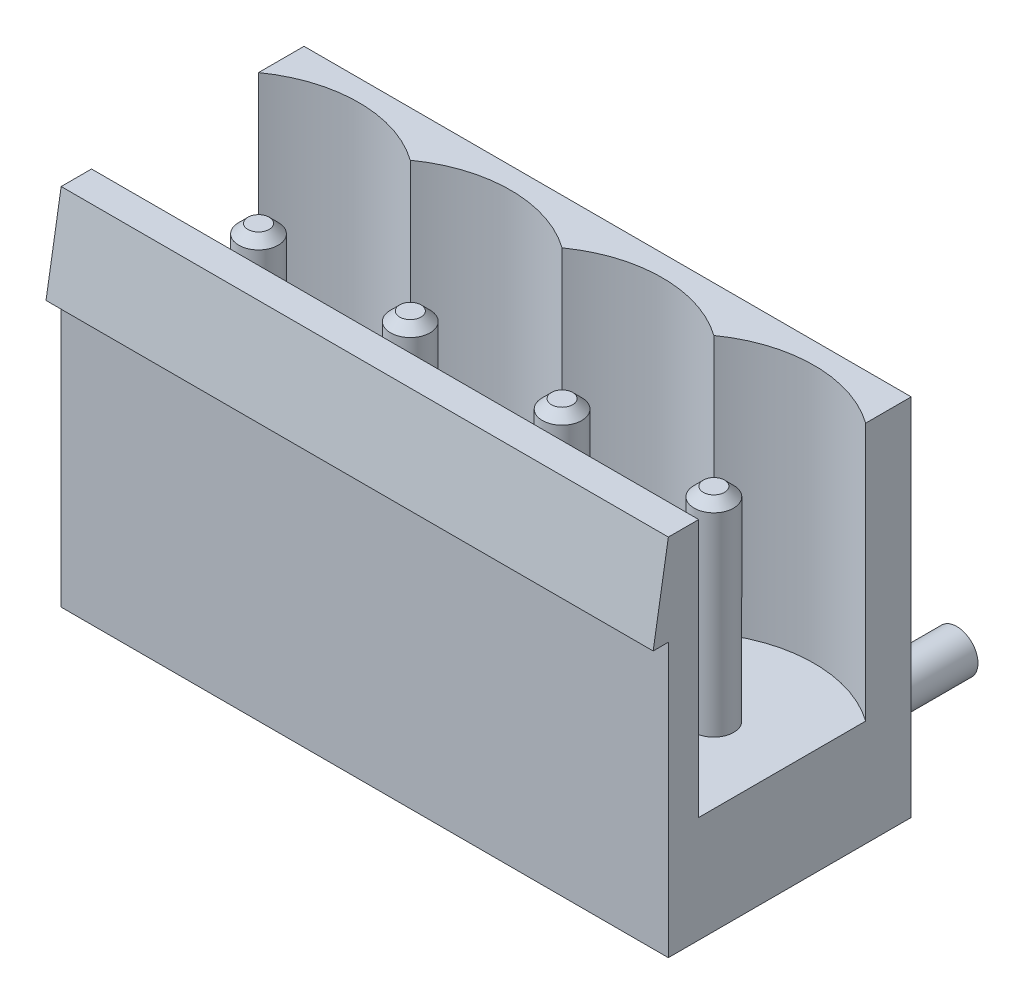
from build123d import *

# Parameters (mm, degrees)
EXTRUDE_1_DEPTH                    = 20
SKETCH_5_R                         = 0.7
EXTRUDE_3_DEPTH                    = 4
CUT_EXTRUDE_1_DEPTH                = 8.5
SKETCH_7_R                         = 0.65
EXTRUDE_4_DEPTH                    = 6.7
CHAMFER_1_SIZE                     = 0.3
PATTERN_LINEAR_2_COUNT             = 4
PATTERN_LINEAR_2_PITCH             = 5
PATTERN_LINEAR_3_COUNT             = 4
PATTERN_LINEAR_3_PITCH             = 5
CHAMFER_1_OF_PATTERN_LINEAR_3_SIZE = 0.3
EXTRUDE_5_DEPTH                    = 0.5
EXTRUDE_6_DEPTH                    = 0.5
CUT_EXTRUDE_2_REACH                = 28.613
SKETCH_10_W                        = 0.5
SKETCH_10_H                        = 8.5


with BuildPart() as part:
    # Эскиз1 → Вытянуть1 (new body)
    with BuildSketch(Plane(origin=(0, 0, 0), x_dir=(0, -1, 0), z_dir=(1, 0, 0))):
        Polygon((-9, 0), (-9, -0.5), (-12, 0), (-12, 8), (0, 8), (0, 0), align=None)
    extrude(amount=EXTRUDE_1_DEPTH)

    # Эскиз5 → Вытянуть3 (add)
    with BuildSketch(Plane(origin=(0, 8, -8), x_dir=(1, 0, 0), z_dir=(0, 0, 1))):
        with Locations((2.5, -6.5)):
            Circle(SKETCH_5_R)
    extrude_3 = extrude(amount=-EXTRUDE_3_DEPTH)

    # Эскиз6 → Вырез-Вытянуть1 (cut)
    with BuildSketch(Plane(origin=(0, 12, 0), x_dir=(1, 0, 0), z_dir=(0, 1, 0))):
        with BuildLine():
            Line((0, 6.5), (0, 1))
            Line((0, 1), (5, 1))
            Line((5, 1), (5, 6.5))
            ThreePointArc((5, 6.5), (2.5, 7.3), (0, 6.5))
        make_face()
    cut_extrude_1 = extrude(amount=-CUT_EXTRUDE_1_DEPTH, mode=Mode.SUBTRACT)

    # Эскиз7 → Вытянуть4 (add)
    with BuildSketch(Plane(origin=(0, 3.5, 0), x_dir=(1, 0, 0), z_dir=(0, 1, 0))):
        with Locations(Location((2.5, 4, 0), (0, 0, 90))):
            Circle(SKETCH_7_R)
    extrude_4 = extrude(amount=EXTRUDE_4_DEPTH)

    # Фаска1
    chamfer_1_edges = [part.edges().sort_by_distance(p)[0] for p in [
        (2.5, 10.2, -3.35),
    ]]
    chamfer(chamfer_1_edges, length=CHAMFER_1_SIZE)

    # Линейный массив2: Вытянуть3, Вырез-Вытянуть1 ×4
    with Locations(*[(i * PATTERN_LINEAR_2_PITCH, 0, 0) for i in range(1, PATTERN_LINEAR_2_COUNT)]):
        add(extrude_3)
        add(cut_extrude_1, mode=Mode.SUBTRACT)

    # Линейный массив3: Вытянуть4 ×4
    with Locations(*[(i * PATTERN_LINEAR_3_PITCH, 0, 0) for i in range(1, PATTERN_LINEAR_3_COUNT)]):
        add(extrude_4)

    # Фаска1 of Линейный массив3
    chamfer_1_of_pattern_linear_3_edges = [part.edges().sort_by_distance(p)[0] for p in [
        (7.5, 10.2, -3.35),
        (12.5, 10.2, -3.35),
        (17.5, 10.2, -3.35),
    ]]
    chamfer(chamfer_1_of_pattern_linear_3_edges, length=CHAMFER_1_OF_PATTERN_LINEAR_3_SIZE)

    # Эскиз8 → Вытянуть5 (add)
    with BuildSketch(Plane(origin=(20, 0, 0), x_dir=(0, 0, -1), z_dir=(1, 0, 0))):
        Polygon((0, 12), (8, 12), (8, 0), (0, 0), (0, 9), (-0.5, 9), align=None)
    extrude(amount=EXTRUDE_5_DEPTH)

    # Эскиз9 → Вытянуть6 (add)
    with BuildSketch(Plane.ZY):
        Polygon((-8, 12), (0, 12), (0.5, 9), (0, 9), (0, 0), (-8, 0), align=None)
    extrude(amount=EXTRUDE_6_DEPTH)

    # Эскиз10 → Вырез-Вытянуть2 (cut, up to next)
    with BuildSketch(Plane(origin=(0, 12, 0), x_dir=(1, 0, 0), z_dir=(0, 1, 0)), mode=Mode.PRIVATE) as cut_extrude_2_sk1:
        with Locations((20.25, 3.75)):
            Rectangle(SKETCH_10_W, SKETCH_10_H)
    cut_extrude_2_tool1 = extrude(cut_extrude_2_sk1.sketch, amount=-CUT_EXTRUDE_2_REACH, mode=Mode.PRIVATE) & part.part
    # Эскиз10 → Вырез-Вытянуть2 (cut, up to next)
    with BuildSketch(Plane(origin=(0, 12, 0), x_dir=(1, 0, 0), z_dir=(0, 1, 0)), mode=Mode.PRIVATE) as cut_extrude_2_sk2:
        with Locations((-0.25, 3.75)):
            Rectangle(SKETCH_10_W, SKETCH_10_H)
    cut_extrude_2_tool2 = extrude(cut_extrude_2_sk2.sketch, amount=-CUT_EXTRUDE_2_REACH, mode=Mode.PRIVATE) & part.part
    add(cut_extrude_2_tool1.solids().sort_by_distance((20.25, 12, -3.75))[0], mode=Mode.SUBTRACT)
    add(cut_extrude_2_tool2.solids().sort_by_distance((-0.25, 12, -3.75))[0], mode=Mode.SUBTRACT)


solid = part.part
